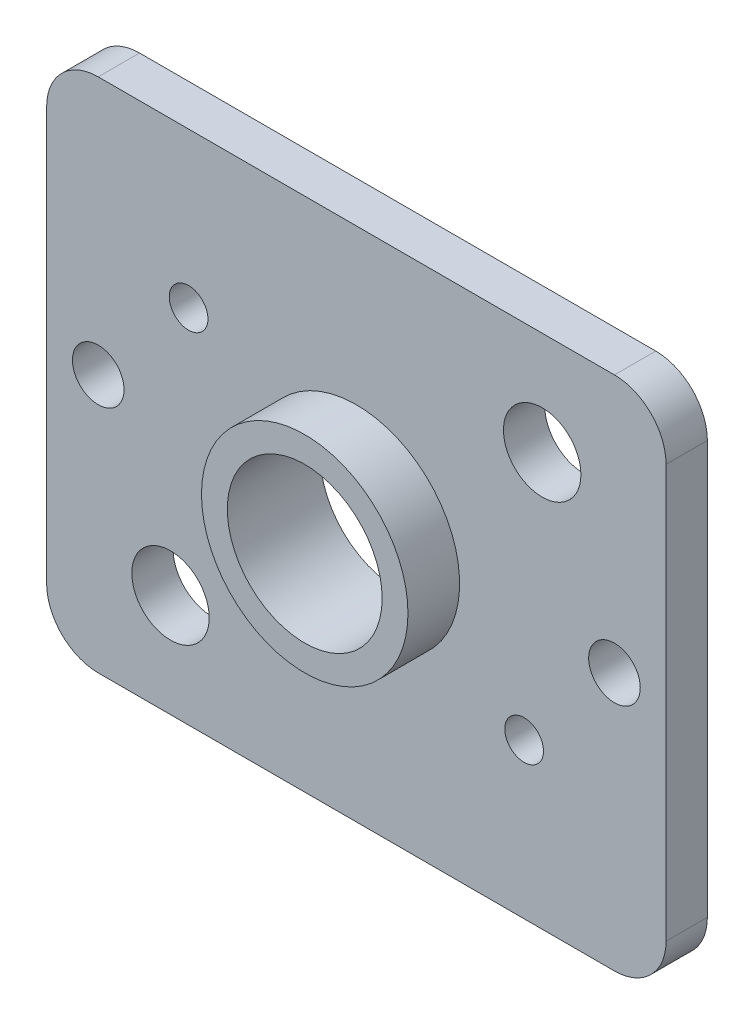
from build123d import *

# Parameters (mm, degrees)
SKETCH_1_W          = 12
SKETCH_1_H          = 10
EXTRUDE_1_DEPTH     = 0.8
CUT_EXTRUDE_1_REACH = 9.851
SKETCH_2_R          = 1.5
SKETCH_2_R_2        = 0.75
SKETCH_2_R_3        = 0.375
FILLET_1_R          = 1
SKETCH_5_R          = 0.5
CUT_EXTRUDE_2_DEPTH = 8.851114571
EXTRUDE_START       = 1
SKETCH_14_R         = 2
SKETCH_14_R_2       = 1.5
EXTRUDE_2_DEPTH     = 1


with BuildPart() as part:
    # Эскиз1 → Бобышка-Вытянуть1 (new body)
    with BuildSketch(Plane.XY):
        Rectangle(SKETCH_1_W, SKETCH_1_H)
    extrude(amount=EXTRUDE_1_DEPTH)

    # Эскиз2 → Вырез-Вытянуть1 (cut, up to next)
    with BuildSketch(Plane.XY.offset(0.8), mode=Mode.PRIVATE) as cut_extrude_1_sk1:
        Circle(SKETCH_2_R)
    cut_extrude_1_tool1 = extrude(cut_extrude_1_sk1.sketch, amount=-CUT_EXTRUDE_1_REACH, mode=Mode.PRIVATE) & part.part
    # Эскиз2 → Вырез-Вытянуть1 (cut, up to next)
    with BuildSketch(Plane.XY.offset(0.8), mode=Mode.PRIVATE) as cut_extrude_1_sk2:
        with Locations((-3.6, -3)):
            Circle(SKETCH_2_R_2)
    cut_extrude_1_tool2 = extrude(cut_extrude_1_sk2.sketch, amount=-CUT_EXTRUDE_1_REACH, mode=Mode.PRIVATE) & part.part
    # Эскиз2 → Вырез-Вытянуть1 (cut, up to next)
    with BuildSketch(Plane.XY.offset(0.8), mode=Mode.PRIVATE) as cut_extrude_1_sk3:
        with Locations((3.6, 3)):
            Circle(SKETCH_2_R_2)
    cut_extrude_1_tool3 = extrude(cut_extrude_1_sk3.sketch, amount=-CUT_EXTRUDE_1_REACH, mode=Mode.PRIVATE) & part.part
    # Эскиз2 → Вырез-Вытянуть1 (cut, up to next)
    with BuildSketch(Plane.XY.offset(0.8), mode=Mode.PRIVATE) as cut_extrude_1_sk4:
        with Locations((3.25, -2)):
            Circle(SKETCH_2_R_3)
    cut_extrude_1_tool4 = extrude(cut_extrude_1_sk4.sketch, amount=-CUT_EXTRUDE_1_REACH, mode=Mode.PRIVATE) & part.part
    # Эскиз2 → Вырез-Вытянуть1 (cut, up to next)
    with BuildSketch(Plane.XY.offset(0.8), mode=Mode.PRIVATE) as cut_extrude_1_sk5:
        with Locations((-3.25, 2)):
            Circle(SKETCH_2_R_3)
    cut_extrude_1_tool5 = extrude(cut_extrude_1_sk5.sketch, amount=-CUT_EXTRUDE_1_REACH, mode=Mode.PRIVATE) & part.part
    add(cut_extrude_1_tool1.solids().sort_by_distance((0, 0, 0.8))[0], mode=Mode.SUBTRACT)
    add(cut_extrude_1_tool2.solids().sort_by_distance((-3.6, -3, 0.8))[0], mode=Mode.SUBTRACT)
    add(cut_extrude_1_tool3.solids().sort_by_distance((3.6, 3, 0.8))[0], mode=Mode.SUBTRACT)
    add(cut_extrude_1_tool4.solids().sort_by_distance((3.25, -2, 0.8))[0], mode=Mode.SUBTRACT)
    add(cut_extrude_1_tool5.solids().sort_by_distance((-3.25, 2, 0.8))[0], mode=Mode.SUBTRACT)

    # Скругление1
    fillet_1_edges = [part.edges().sort_by_distance(p)[0] for p in [
        (6, -5, 0.4),
        (-6, -5, 0.4),
        (-6, 5, 0.4),
        (6, 5, 0.4),
    ]]
    fillet(fillet_1_edges, radius=FILLET_1_R)

    # Эскиз5 → Вырез-Вытянуть2 (cut, through all)
    with BuildSketch(Plane.XY.offset(0.8)):
        with Locations((5, 0)):
            Circle(SKETCH_5_R)
        with Locations((-5, 0)):
            Circle(SKETCH_5_R)
    extrude(amount=-CUT_EXTRUDE_2_DEPTH, mode=Mode.SUBTRACT)

    # Эскиз14 → Бобышка-Вытянуть2 (add)
    with BuildSketch(Plane.XY.offset(0.8).offset(EXTRUDE_START)):
        with Locations(Location((0, 0, 0), (0, 0, 180))):
            Circle(SKETCH_14_R)
        Circle(SKETCH_14_R_2, mode=Mode.SUBTRACT)
    extrude(amount=-EXTRUDE_2_DEPTH)


solid = part.part
